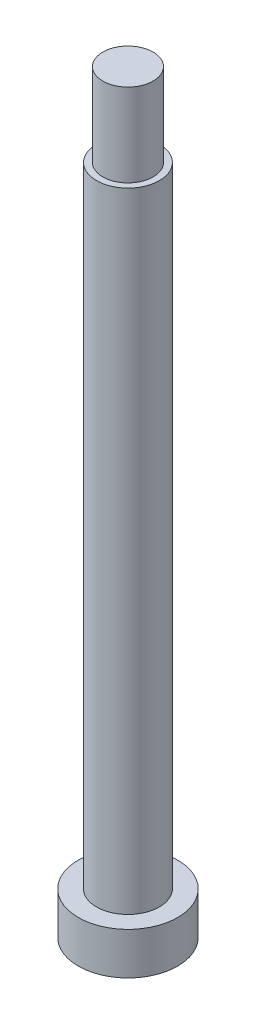
from build123d import *

# Parameters (mm, degrees)
SKETCH_1_R          = 4
EXTRUDE_1_DEPTH     = 119.9
SKETCH_1_3_R        = 5
SKETCH_1_3_R_2      = 4
EXTRUDE_2_DEPTH     = 106.7
SKETCH_1_4_R        = 7.9
SKETCH_1_4_R_2      = 5
EXTRUDE_3_DEPTH     = 6.7
CUT_EXTRUDE_1_DEPTH = 3


with BuildPart() as part:
    # 草图1 → 凸台-拉伸1 (new body)
    with BuildSketch(Plane(origin=(0, 0, 0), x_dir=(1, 0, 0), z_dir=(0, 1, 0))):
        Circle(SKETCH_1_R)
    extrude(amount=EXTRUDE_1_DEPTH)

    # 草图1<3> → 凸台-拉伸2 (add)
    with BuildSketch(Plane(origin=(0, 0, 0), x_dir=(1, 0, 0), z_dir=(0, 1, 0))):
        Circle(SKETCH_1_3_R)
        Circle(SKETCH_1_3_R_2, mode=Mode.SUBTRACT)
    extrude(amount=EXTRUDE_2_DEPTH)

    # 草图1<4> → 凸台-拉伸3 (add)
    with BuildSketch(Plane(origin=(0, 0, 0), x_dir=(1, 0, 0), z_dir=(0, 1, 0))):
        Circle(SKETCH_1_4_R)
        Circle(SKETCH_1_4_R_2, mode=Mode.SUBTRACT)
    extrude(amount=EXTRUDE_3_DEPTH)

    # 草图2 → 切除-拉伸1 (cut)
    with BuildSketch(Plane.XZ):
        Polygon((2.5, 1.443375673), (0, 2.886751346), (-2.5, 1.443375673), (-2.5, -1.443375673), (0, -2.886751346), (2.5, -1.443375673), align=None)
    extrude(amount=-CUT_EXTRUDE_1_DEPTH, mode=Mode.SUBTRACT)


solid = part.part
